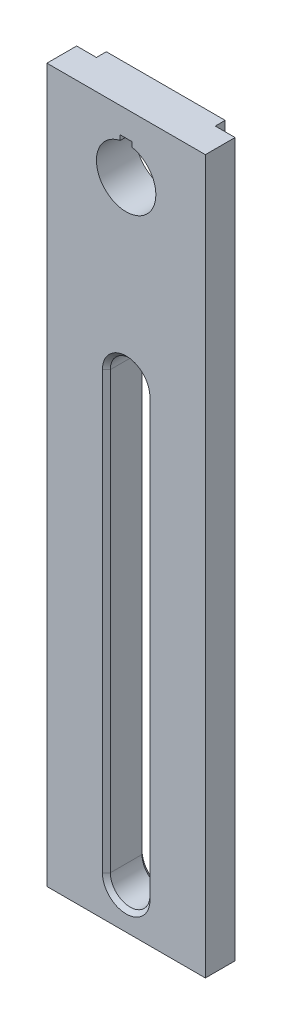
from build123d import *

# Parameters (mm, degrees)
SZKIC1_W                    = 40
SZKIC1_H                    = 180
DODANIE_WYCI_GNI_CIE1_DEPTH = 10
SZKIC2_W                    = 5
SZKIC2_H                    = 2.5
WYTNIJ_WYCI_GNI_CIE1_DEPTH  = 182.383571472
SFAZOWANIE1_SIZE            = 1


with BuildPart() as part:
    # Szkic1 → Dodanie-wyciągnięcie1 (new body)
    with BuildSketch(Plane.XY):
        with Locations((0, 110)):
            Rectangle(SZKIC1_W, SZKIC1_H)
        with BuildLine():
            Line((1.493515455, 193.580554333), (-1.493515455, 193.580554333))
            Line((-1.493515455, 193.580554333), (-1.493515455, 192.349789901))
            ThreePointArc((-1.493515455, 192.349789901), (0, 177.5), (1.493515455, 192.349789901))
            Line((1.493515455, 192.349789901), (1.493515455, 193.580554333))
        make_face(mode=Mode.SUBTRACT)
        with BuildLine():
            Line((5, 140), (5, 30))
            ThreePointArc((5, 30), (0, 25), (-5, 30))
            Line((-5, 30), (-5, 140))
            ThreePointArc((-5, 140), (0, 145), (5, 140))
        make_face(mode=Mode.SUBTRACT)
    extrude(amount=DODANIE_WYCI_GNI_CIE1_DEPTH)

    # Szkic2 → Wytnij-wyciągnięcie1 (cut, through all)
    with BuildSketch(Plane(origin=(0, 200, 0), x_dir=(1, 0, 0), z_dir=(0, 1, 0))):
        with Locations((-17.5, -1.25)):
            Rectangle(SZKIC2_W, SZKIC2_H)
        with Locations((17.5, -1.25)):
            Rectangle(SZKIC2_W, SZKIC2_H)
    extrude(amount=-WYTNIJ_WYCI_GNI_CIE1_DEPTH, mode=Mode.SUBTRACT)

    # Sfazowanie1
    sfazowanie1_edges = [part.edges().sort_by_distance(p)[0] for p in [
        (0, 145, 0),
        (-5, 85, 0),
        (0, 25, 0),
        (5, 85, 0),
        (0, 145, 10),
        (-5, 85, 10),
        (0, 25, 10),
        (5, 85, 10),
    ]]
    chamfer(sfazowanie1_edges, length=SFAZOWANIE1_SIZE)


solid = part.part
